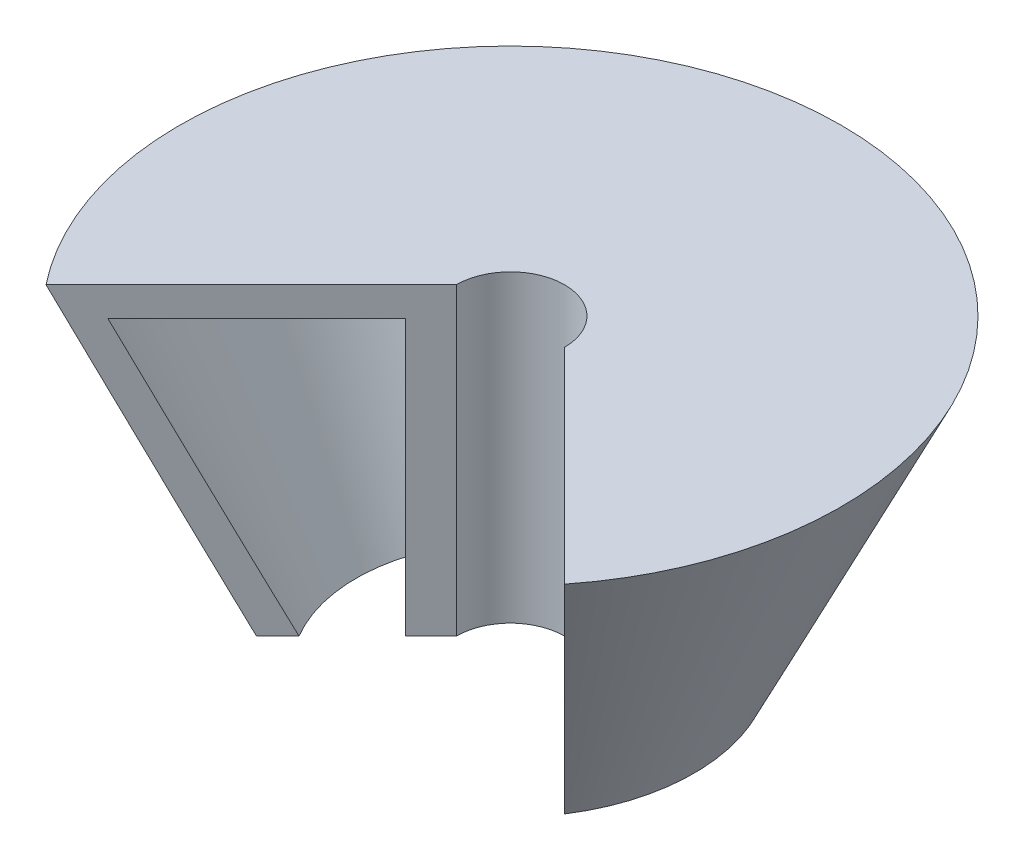
from build123d import *

# Parameters (mm, degrees)
CORTAR_EXTRUIR1_DEPTH = 11


with BuildPart() as part:
    # Croquis1 → Revolución1 (revolve)
    with BuildSketch(Plane.XY, mode=Mode.PRIVATE) as revoluci_n1_sk:
        Polygon((-89.306368068, 4.546251994), (-84.281368068, -5.853748006), (-83.280541145, -5.853748006), (-87.822368068, 3.546251994), (-80.856368068, 3.546251994), (-80.856368068, -5.853748006), (-79.856368068, -5.853748006), (-79.856368068, 4.546251994), align=None)
    revolve(revoluci_n1_sk.sketch.rotate(Axis((-78.006368068, 33.572966507, 0), (0, -1, 0)), 270), axis=Axis((-78.006368068, 33.572966507, 0), (0, -1, 0)))

    # Croquis2 → Cortar-Extruir1 (cut)
    with BuildSketch(Plane(origin=(0, 4.546251994, 0), x_dir=(1, 0, 0), z_dir=(0, 1, 0))):
        with BuildLine():
            Line((-76.156368068, 0), (-69.144783475, -7.011584593))
            ThreePointArc((-69.144783475, -7.011584593), (-78.006368068, -11.3), (-86.867952661, -7.011584593))
            Line((-86.867952661, -7.011584593), (-79.856368068, 0))
            ThreePointArc((-79.856368068, 0), (-78.006368068, -1.85), (-76.156368068, 0))
        make_face()
    extrude(amount=-CORTAR_EXTRUIR1_DEPTH, mode=Mode.SUBTRACT)


solid = part.part
